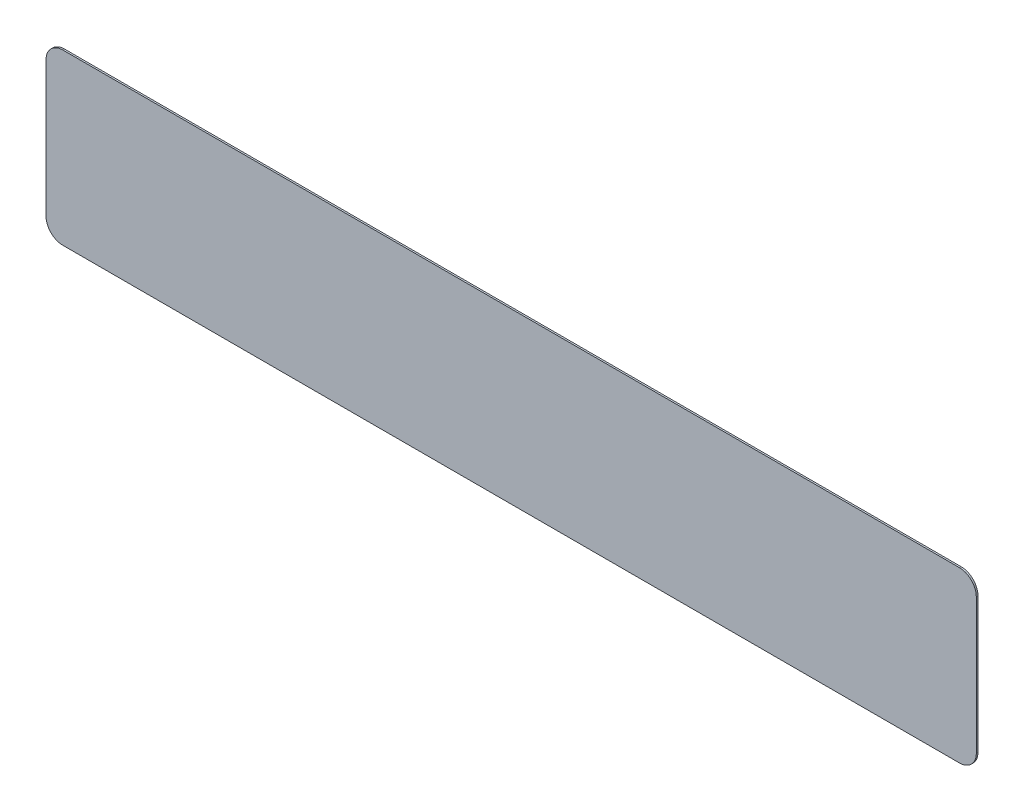
from build123d import *

# Parameters (mm, degrees)
EXTRUDE_1_DEPTH = 0.2


with BuildPart() as part:
    # Эскиз1 → Бобышка-Вытянуть1 (new body)
    with BuildSketch(Plane.XY):
        with BuildLine():
            Line((-53, -10), (53, -10))
            ThreePointArc((53, -10), (54.414213562, -9.414213562), (55, -8))
            Line((55, -8), (55, 8))
            ThreePointArc((55, 8), (54.414213562, 9.414213562), (53, 10))
            Line((53, 10), (-53, 10))
            ThreePointArc((-53, 10), (-54.414213562, 9.414213562), (-55, 8))
            Line((-55, 8), (-55, -8))
            ThreePointArc((-55, -8), (-54.414213562, -9.414213562), (-53, -10))
        make_face()
    extrude(amount=EXTRUDE_1_DEPTH)


solid = part.part
